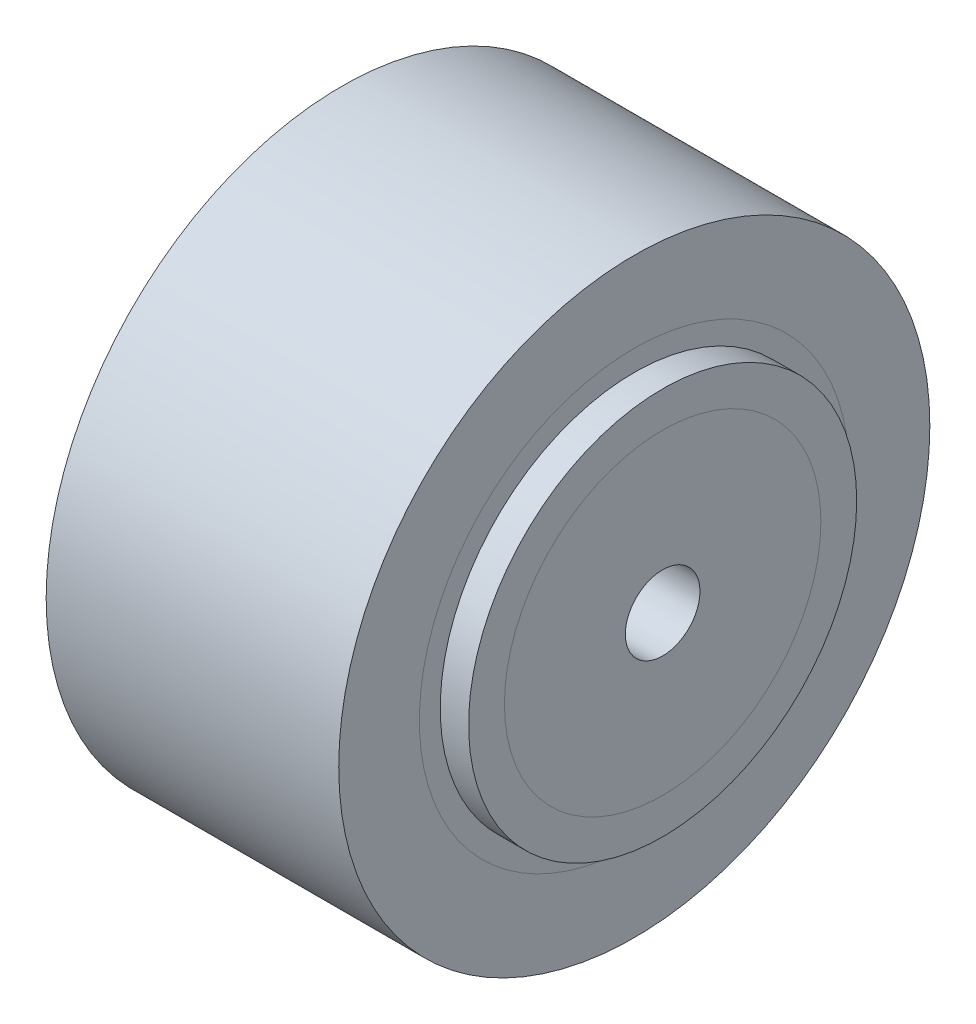
from build123d import *

# Parameters (mm, degrees)
SKETCH1_R            = 19.8
SKETCH1_R_2          = 14.4
BOSS_EXTRUDE4_DEPTH  = 9.8
SKETCH1_6_R          = 14.4
SKETCH1_6_R_2        = 13
BOSS_EXTRUDE5_DEPTH  = 9.8
SKETCH1_7_R          = 13
SKETCH1_7_R_2        = 10.6
BOSS_EXTRUDE6_DEPTH  = 11.7
SKETCH1_8_R          = 10.6
SKETCH1_8_R_2        = 2.5
BOSS_EXTRUDE7_DEPTH  = 11.7
SKETCH2_R            = 14.4
SKETCH2_R_2          = 13
BOSS_EXTRUDE8_DEPTH  = 9.8
SKETCH3_R            = 13
SKETCH3_R_2          = 10.6
BOSS_EXTRUDE9_DEPTH  = 11.7
SKETCH4_R            = 10.6
SKETCH4_R_2          = 2.5
BOSS_EXTRUDE10_DEPTH = 11.7


with BuildPart() as part:
    # Sketch1 → Boss-Extrude4 (new body)
    with BuildSketch(Plane(origin=(0, 0, 0), x_dir=(0, 0, -1), z_dir=(1, 0, 0))):
        Circle(SKETCH1_R)
        Circle(SKETCH1_R_2, mode=Mode.SUBTRACT)
    boss_extrude4 = extrude(amount=BOSS_EXTRUDE4_DEPTH)

    # Mirror3: Boss-Extrude4 across plane
    add(boss_extrude4.mirror(Plane(origin=(0, 0, 0), x_dir=(0, 0, 1), z_dir=(1, 0, 0))))


with BuildPart() as body_2:
    # Sketch1<6> → Boss-Extrude5 (new body)
    with BuildSketch(Plane(origin=(0, 0, 0), x_dir=(0, 0, -1), z_dir=(1, 0, 0))):
        Circle(SKETCH1_6_R)
        Circle(SKETCH1_6_R_2, mode=Mode.SUBTRACT)
    extrude(amount=BOSS_EXTRUDE5_DEPTH)


with BuildPart() as body_3:
    # Sketch1<7> → Boss-Extrude6 (new body)
    with BuildSketch(Plane(origin=(0, 0, 0), x_dir=(0, 0, -1), z_dir=(1, 0, 0))):
        Circle(SKETCH1_7_R)
        Circle(SKETCH1_7_R_2, mode=Mode.SUBTRACT)
    extrude(amount=BOSS_EXTRUDE6_DEPTH)


with BuildPart() as body_4:
    # Sketch1<8> → Boss-Extrude7 (new body)
    with BuildSketch(Plane(origin=(0, 0, 0), x_dir=(0, 0, -1), z_dir=(1, 0, 0))):
        Circle(SKETCH1_8_R)
        Circle(SKETCH1_8_R_2, mode=Mode.SUBTRACT)
    extrude(amount=BOSS_EXTRUDE7_DEPTH)


with BuildPart() as body_5:
    # Sketch2 → Boss-Extrude8 (new body)
    with BuildSketch(Plane.ZY):
        with Locations(Location((0, 0, 0), (0, 0, 180))):
            Circle(SKETCH2_R)
        with Locations(Location((0, 0, 0), (0, 0, 180))):
            Circle(SKETCH2_R_2, mode=Mode.SUBTRACT)
    extrude(amount=BOSS_EXTRUDE8_DEPTH)


with BuildPart() as body_6:
    # Sketch3 → Boss-Extrude9 (new body)
    with BuildSketch(Plane.ZY):
        Circle(SKETCH3_R)
        Circle(SKETCH3_R_2, mode=Mode.SUBTRACT)
    extrude(amount=BOSS_EXTRUDE9_DEPTH)


with BuildPart() as body_7:
    # Sketch4 → Boss-Extrude10 (new body)
    with BuildSketch(Plane.ZY):
        Circle(SKETCH4_R)
        Circle(SKETCH4_R_2, mode=Mode.SUBTRACT)
    extrude(amount=BOSS_EXTRUDE10_DEPTH)


solid = Compound([part.part, body_2.part, body_3.part, body_4.part, body_5.part, body_6.part, body_7.part])
